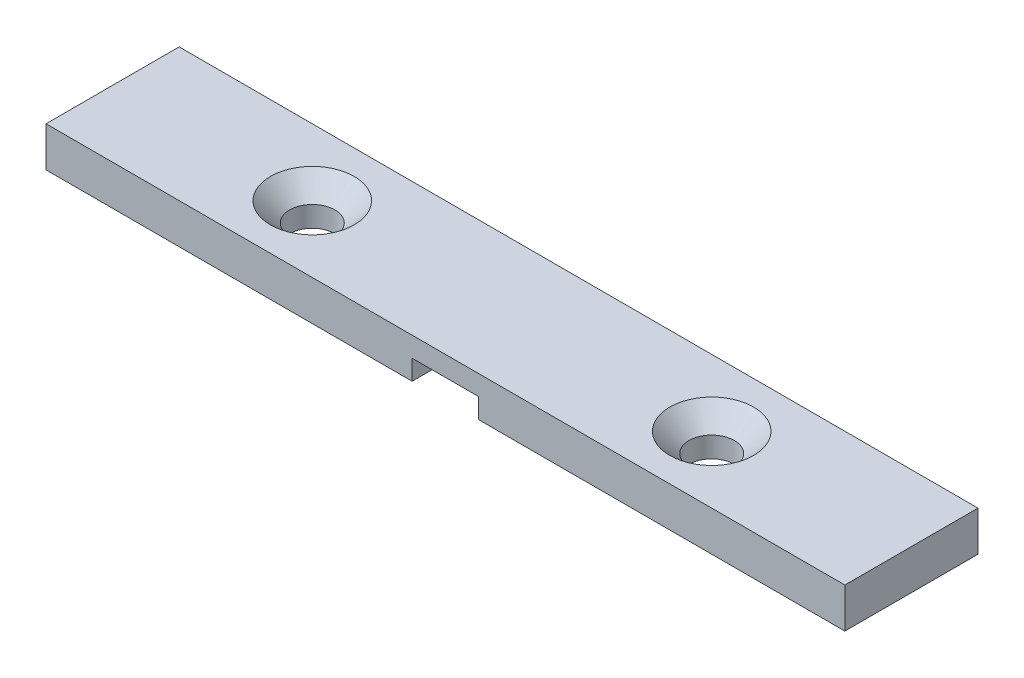
from build123d import *

# Parameters (mm, degrees)
SKETCH1_W                                           = 60
SKETCH1_H                                           = 10
BOSS_EXTRUDE1_DEPTH                                 = 3
CSK_FOR_M3_COUNTERSUNK_FLAT_HEAD_SCREW1_D           = 3.4
CSK_FOR_M3_COUNTERSUNK_FLAT_HEAD_SCREW1_DEPTH       = 7.5
CSK_FOR_M3_COUNTERSUNK_FLAT_HEAD_SCREW1_CSINK_D     = 6.3
CSK_FOR_M3_COUNTERSUNK_FLAT_HEAD_SCREW1_CSINK_ANGLE = 90
CSK_FOR_M3_COUNTERSUNK_FLAT_HEAD_SCREW1_TIP         = 1.021463052
SKETCH4_W                                           = 5
SKETCH4_H                                           = 1.5
CUT_EXTRUDE1_DEPTH                                  = 8.5


with BuildPart() as part:
    # Sketch1 → Boss-Extrude1 (new body)
    with BuildSketch(Plane(origin=(0, 0, 0), x_dir=(1, 0, 0), z_dir=(0, 1, 0))):
        Rectangle(SKETCH1_W, SKETCH1_H)
    extrude(amount=BOSS_EXTRUDE1_DEPTH)

    # CSK for M3 Countersunk Flat Head Screw1
    with Locations(Plane(origin=(-15, 3, 0), x_dir=(0, 0, 1), z_dir=(0, 1, 0))):
        with Locations((0, 0), (0, 30)):
            CounterSinkHole(CSK_FOR_M3_COUNTERSUNK_FLAT_HEAD_SCREW1_D / 2, CSK_FOR_M3_COUNTERSUNK_FLAT_HEAD_SCREW1_CSINK_D / 2, depth=CSK_FOR_M3_COUNTERSUNK_FLAT_HEAD_SCREW1_DEPTH, counter_sink_angle=CSK_FOR_M3_COUNTERSUNK_FLAT_HEAD_SCREW1_CSINK_ANGLE)
            with Locations((0, 0, -(CSK_FOR_M3_COUNTERSUNK_FLAT_HEAD_SCREW1_DEPTH + CSK_FOR_M3_COUNTERSUNK_FLAT_HEAD_SCREW1_TIP / 2))):  # 118° drill point
                Cone(0, CSK_FOR_M3_COUNTERSUNK_FLAT_HEAD_SCREW1_D / 2, CSK_FOR_M3_COUNTERSUNK_FLAT_HEAD_SCREW1_TIP, mode=Mode.SUBTRACT)

    # Sketch4 → Cut-Extrude1 (cut)
    with BuildSketch(Plane.XY.offset(5)):
        with Locations((0, 0.75)):
            Rectangle(SKETCH4_W, SKETCH4_H)
    extrude(amount=-CUT_EXTRUDE1_DEPTH, mode=Mode.SUBTRACT)


solid = part.part
